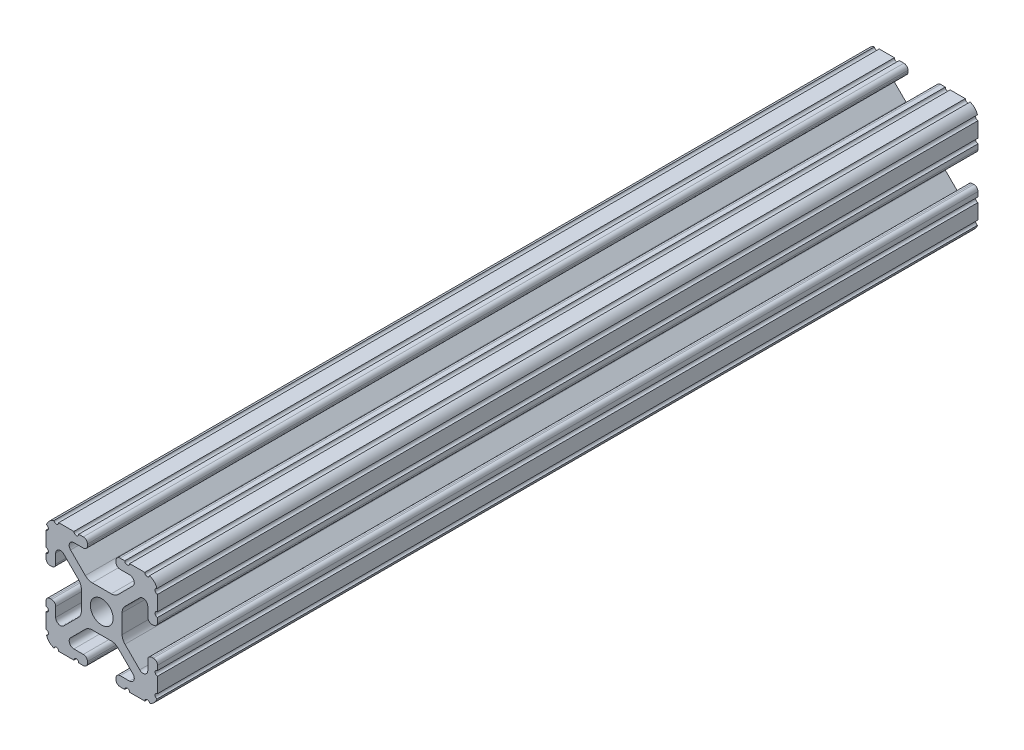
from build123d import *

# Parameters (mm, degrees)
BOSS_EXTRUDE1_START     = -93.484453
BOSS_EXTRUDE1_DEPTH     = 186.968906
CUT_EXTRUDE1_DEPTH      = 96.194132974
CUT_EXTRUDE1_DEPTH_BACK = 96.194132974
SKETCH5_R               = 0.55245


with BuildPart() as part:
    # Sketch4 → Boss-Extrude1 (new body)
    with BuildSketch(Plane.XY.offset(BOSS_EXTRUDE1_START)):
        with BuildLine():
            Line((4.190365, -12.7), (10.11729625, -12.7))
            ThreePointArc((10.11729625, -12.7), (11.943543585, -11.943543585), (12.7, -10.11729625))
            Line((12.7, -10.11729625), (12.7, -4.190365))
            ThreePointArc((12.7, -4.190365), (12.42492494, -3.52627506), (11.760835, -3.2512))
            Line((11.760835, -3.2512), (11.429365, -3.2512))
            ThreePointArc((11.429365, -3.2512), (10.76527506, -3.52627506), (10.4902, -4.190365))
            Line((10.4902, -4.190365), (10.4902, -6.348478019))
            ThreePointArc((10.4902, -6.348478019), (9.830707141, -7.335478831), (8.666460301, -7.103895736))
            Line((8.666460301, -7.103895736), (5.299899128, -3.737334563))
            ThreePointArc((5.299899128, -3.737334563), (4.817571085, -3.015479634), (4.6482, -2.16399369))
            Line((4.6482, -2.16399369), (4.6482, 0))
            Line((4.6482, 0), (2.6035, 0))
            ThreePointArc((2.6035, 0), (1.840952505, -1.840952505), (0, -2.6035))
            Line((0, -2.6035), (0, -4.6482))
            Line((0, -4.6482), (2.16399369, -4.6482))
            ThreePointArc((2.16399369, -4.6482), (3.015479634, -4.817571085), (3.737334563, -5.299899128))
            Line((3.737334563, -5.299899128), (7.103895736, -8.666460301))
            ThreePointArc((7.103895736, -8.666460301), (7.335478831, -9.830707141), (6.348478019, -10.4902))
            Line((6.348478019, -10.4902), (4.190365, -10.4902))
            ThreePointArc((4.190365, -10.4902), (3.52627506, -10.76527506), (3.2512, -11.429365))
            Line((3.2512, -11.429365), (3.2512, -11.760835))
            ThreePointArc((3.2512, -11.760835), (3.52627506, -12.42492494), (4.190365, -12.7))
        make_face()
    extrude(amount=BOSS_EXTRUDE1_DEPTH)

    # Sketch5 → Cut-Extrude1 (cut, two sides: drawn at the far end of the back side and taken through both)
    with BuildSketch(Plane.XY.offset(-CUT_EXTRUDE1_DEPTH_BACK)):
        with Locations((10.356153152, -12.7)):
            Circle(SKETCH5_R)
        with Locations((5.796028019, -12.7)):
            Circle(SKETCH5_R)
        with Locations((12.7, -10.356153152)):
            Circle(SKETCH5_R)
        with Locations((12.7, -5.796028019)):
            Circle(SKETCH5_R)
    extrude(amount=CUT_EXTRUDE1_DEPTH + CUT_EXTRUDE1_DEPTH_BACK, mode=Mode.SUBTRACT)

    # Mirror1: part across plane


with BuildPart() as part_1:
    add(part.part)
    add(part.part.mirror(Plane(origin=(0, 0, 0), x_dir=(0, 0, 1), z_dir=(1, 0, 0))))

    # Mirror2: part across plane


with BuildPart() as part_2:
    add(part_1.part)
    add(part_1.part.mirror(Plane.ZX))


solid = part_2.part
